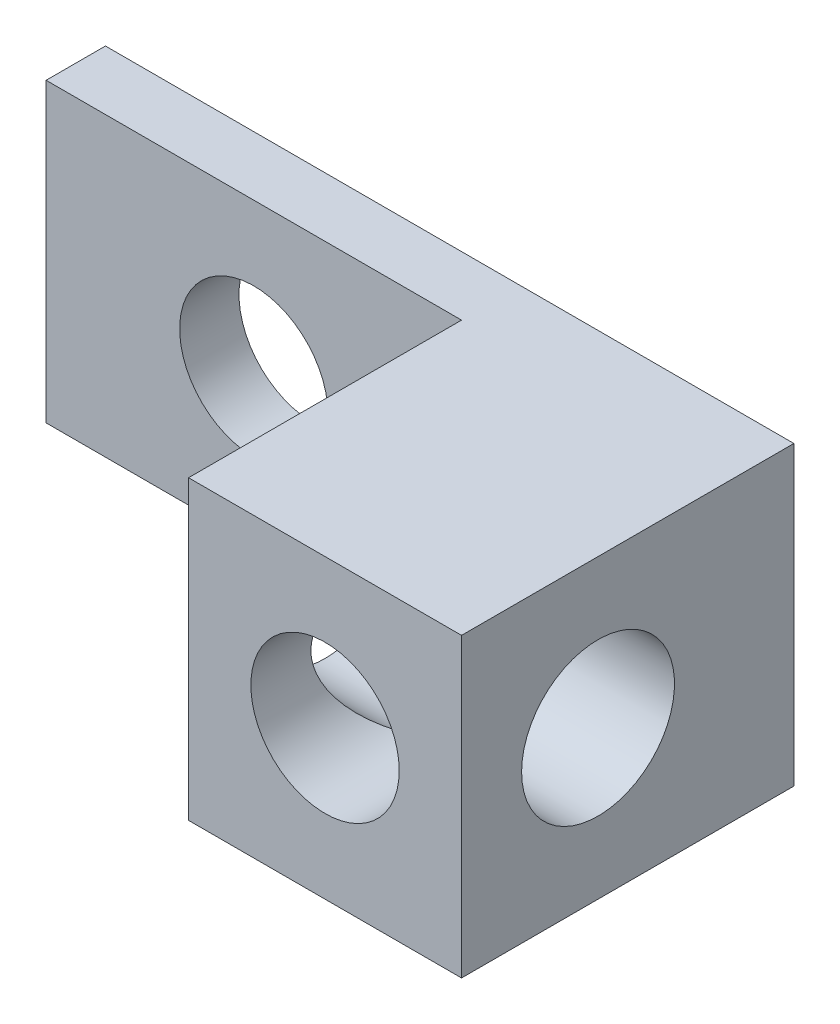
from build123d import *

# Parameters (mm, degrees)
EXTRUDE1_DEPTH      = 12.7
SKETCH2_R           = 3.27152
EXTRUDE2_DEPTH      = 27.071834918
EXTRUDE3_REACH      = 37.096
EXTRUDE3_END_RADIUS = 3.27152
SKETCH3_R           = 3.175
SKETCH4_R           = 3.175
EXTRUDE4_DEPTH      = 35.145763344


with BuildPart() as part:
    # Sketch1 → Extrude1 (new body)
    with BuildSketch(Plane(origin=(0, 0, 0), x_dir=(1, 0, 0), z_dir=(0, 1, 0))):
        Polygon((0, 0), (0, -14.224), (-11.684, -14.224), (-11.684, -2.54), (-29.464, -2.54), (-29.464, 0), align=None)
    extrude(amount=EXTRUDE1_DEPTH)

    # Sketch2 → Extrude2 (cut, through all)
    with BuildSketch(Plane.ZY.offset(11.684)):
        with Locations((8.382, 6.35)):
            Circle(SKETCH2_R)
    extrude(amount=-EXTRUDE2_DEPTH, mode=Mode.SUBTRACT)

    # Extrude3: up to this cylinder (the profile starts outside it)
    extrude3_end = Plane(origin=(-5.842, 6.35, 8.382), z_dir=(-1, 0, 0)) * Cylinder(EXTRUDE3_END_RADIUS, 81.73504, mode=Mode.PRIVATE)
    # Sketch3 → Extrude3 (cut, up to the surface)
    with BuildSketch(Plane.XY.offset(14.224), mode=Mode.PRIVATE) as extrude3_sk1:
        with Locations((-5.842, 6.35)):
            Circle(SKETCH3_R)
    extrude3_tool1 = extrude(extrude3_sk1.sketch, amount=-EXTRUDE3_REACH, mode=Mode.PRIVATE) - extrude3_end
    add(extrude3_tool1.solids().sort_by_distance((-5.842, 6.35, 14.224))[0], mode=Mode.SUBTRACT)

    # Sketch4 → Extrude4 (cut, through all)
    with BuildSketch(Plane.XY.offset(2.54)):
        with Locations((-20.574, 6.35)):
            Circle(SKETCH4_R)
    extrude(amount=-EXTRUDE4_DEPTH, mode=Mode.SUBTRACT)


solid = part.part
